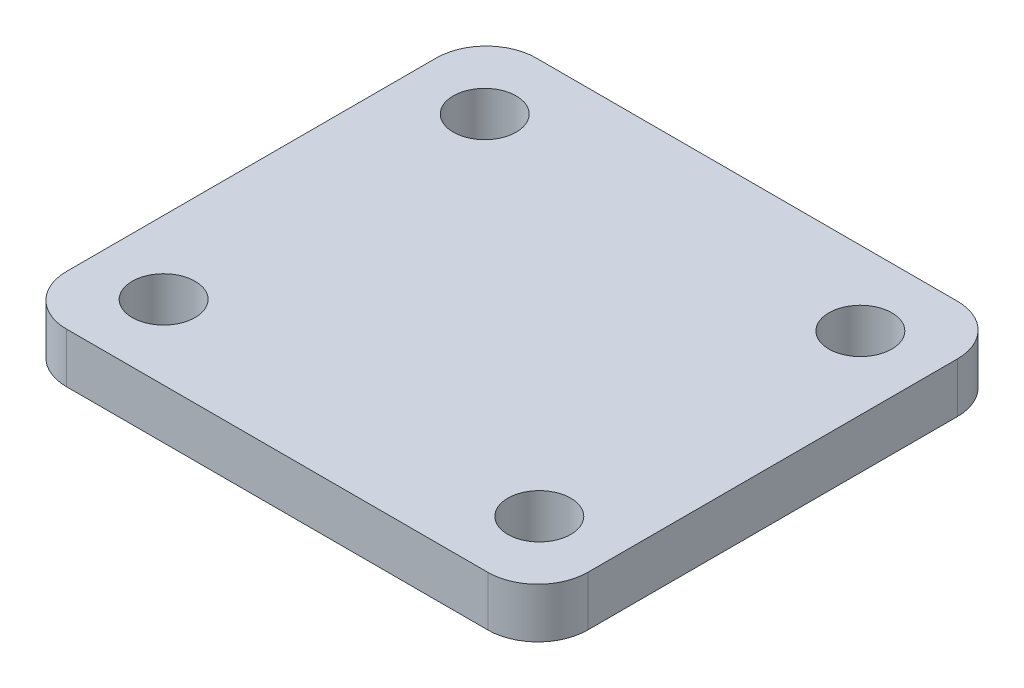
from build123d import *

# Parameters (mm, degrees)
BOSS_EXTRUDE1_DEPTH = 2.54
SKETCH2_R           = 1.6
CUT_EXTRUDE1_DEPTH  = 19.014383348


with BuildPart() as part:
    # Sketch1 → Boss-Extrude1 (new body)
    with BuildSketch(Plane(origin=(0, 0, 0), x_dir=(1, 0, 0), z_dir=(0, 1, 0))):
        with BuildLine():
            Line((-10.710000043, -11.937500001), (10.709999957, -11.937500001))
            ThreePointArc((10.709999957, -11.937500001), (12.506051181, -11.193551225), (13.249999957, -9.397500001))
            Line((13.249999957, -9.397500001), (13.249999957, 9.397499999))
            ThreePointArc((13.249999957, 9.397499999), (12.506051181, 11.193551223), (10.709999957, 11.937499999))
            Line((10.709999957, 11.937499999), (-10.710000043, 11.937499999))
            ThreePointArc((-10.710000043, 11.937499999), (-12.506051267, 11.193551223), (-13.250000043, 9.397499999))
            Line((-13.250000043, 9.397499999), (-13.250000043, -9.397500001))
            ThreePointArc((-13.250000043, -9.397500001), (-12.506051267, -11.193551225), (-10.710000043, -11.937500001))
        make_face()
    extrude(amount=BOSS_EXTRUDE1_DEPTH)

    # Sketch2 → Cut-Extrude1 (cut, through all)
    with BuildSketch(Plane(origin=(0, 2.54, 0), x_dir=(1, 0, 0), z_dir=(0, 1, 0))):
        with Locations(Location((-9.54999995, 8.162500058, 0), (0, 0, 270))):
            Circle(SKETCH2_R)
        with Locations(Location((9.55000005, 8.162500058, 0), (0, 0, 270))):
            Circle(SKETCH2_R)
        with Locations(Location((9.55000005, -8.162499942, 0), (0, 0, 270))):
            Circle(SKETCH2_R)
        with Locations(Location((-9.54999995, -8.162499942, 0), (0, 0, 270))):
            Circle(SKETCH2_R)
    extrude(amount=-CUT_EXTRUDE1_DEPTH, mode=Mode.SUBTRACT)


solid = part.part
